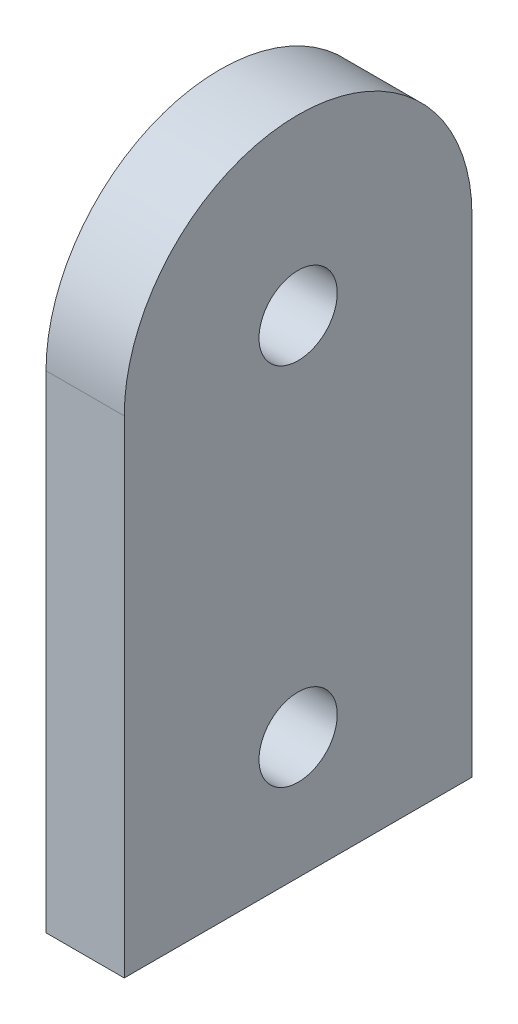
from build123d import *

# Parameters (mm, degrees)
SKETCH_1_R      = 2.25
EXTRUDE_1_DEPTH = 4.5


with BuildPart() as part:
    # 草图1 → 凸台-拉伸1 (new body)
    with BuildSketch(Plane(origin=(0, 0, 0), x_dir=(0, 0, -1), z_dir=(1, 0, 0))):
        with BuildLine():
            Line((0, 0), (20, 0))
            Line((20, 0), (20, 28))
            ThreePointArc((20, 28), (10, 38), (0, 28))
            Line((0, 28), (0, 0))
        make_face()
        with Locations((10, 28)):
            Circle(SKETCH_1_R, mode=Mode.SUBTRACT)
        with Locations((10, 7)):
            Circle(SKETCH_1_R, mode=Mode.SUBTRACT)
    extrude(amount=EXTRUDE_1_DEPTH)


solid = part.part
